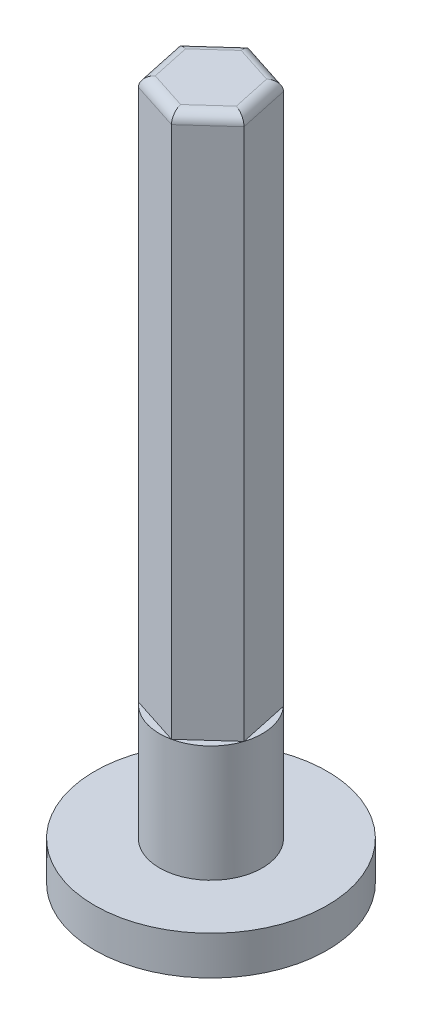
from build123d import *

# Parameters (mm, degrees)
CROQUIS1_R              = 9
SALIENTE_EXTRUIR1_DEPTH = 3
CROQUIS2_R              = 3.975
SALIENTE_EXTRUIR2_DEPTH = 9
SALIENTE_EXTRUIR3_DEPTH = 42
REDONDEO1_R             = 0.8


with BuildPart() as part:
    # Croquis1 → Saliente-Extruir1 (new body)
    with BuildSketch(Plane(origin=(0, 0, 0), x_dir=(1, 0, 0), z_dir=(0, 1, 0))):
        with Locations(Location((0, 0, 0), (0, 0, 270))):
            Circle(CROQUIS1_R)
    extrude(amount=SALIENTE_EXTRUIR1_DEPTH)

    # Croquis2 → Saliente-Extruir2 (add)
    with BuildSketch(Plane(origin=(0, 3, 0), x_dir=(1, 0, 0), z_dir=(0, 1, 0))):
        with Locations(Location((0, 0, 0), (0, 0, 270))):
            Circle(CROQUIS2_R)
    extrude(amount=SALIENTE_EXTRUIR2_DEPTH)

    # Croquis3 → Saliente-Extruir3 (add)
    with BuildSketch(Plane(origin=(0, 12, 0), x_dir=(1, 0, 0), z_dir=(0, 1, 0))):
        Polygon((-2.949727384, -2.664532485), (0.832689129, -3.886805091), (3.782416513, -1.222272606), (2.949727384, 2.664532485), (-0.832689129, 3.886805091), (-3.782416513, 1.222272606), align=None)
    extrude(amount=SALIENTE_EXTRUIR3_DEPTH)

    # Redondeo1
    redondeo1_edges = [part.edges().sort_by_distance(p)[0] for p in [
        (-1.058519127, 54, 3.275668788),
        (2.307552821, 54, 2.554538849),
        (3.366071948, 54, -0.721129939),
        (1.058519127, 54, -3.275668788),
        (-2.307552821, 54, -2.554538849),
        (-3.366071948, 54, 0.721129939),
    ]]
    fillet(redondeo1_edges, radius=REDONDEO1_R)


solid = part.part
